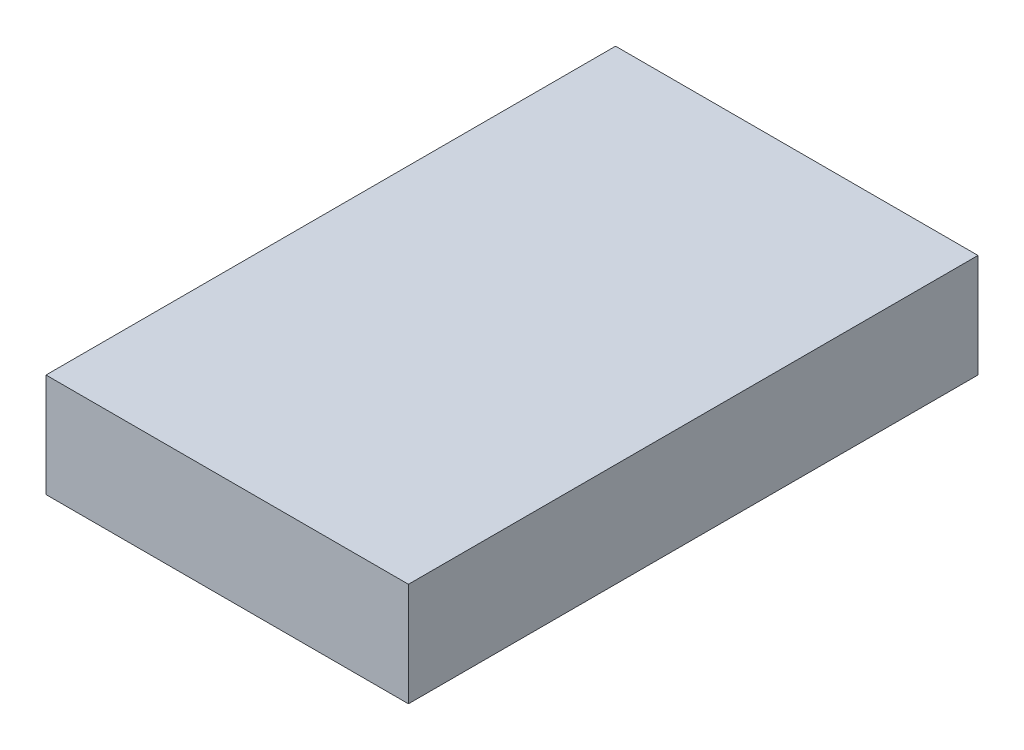
from build123d import *

# Parameters (mm, degrees)
SKETCH1_W           = 44.45
SKETCH1_H           = 69.85
BOSS_EXTRUDE1_DEPTH = 6.35


with BuildPart() as part:
    # Sketch1 → Boss-Extrude1 (new, symmetric)
    with BuildSketch(Plane(origin=(0, 0, 0), x_dir=(1, 0, 0), z_dir=(0, 1, 0))):
        Rectangle(SKETCH1_W, SKETCH1_H)
    extrude(amount=BOSS_EXTRUDE1_DEPTH, both=True)


solid = part.part
